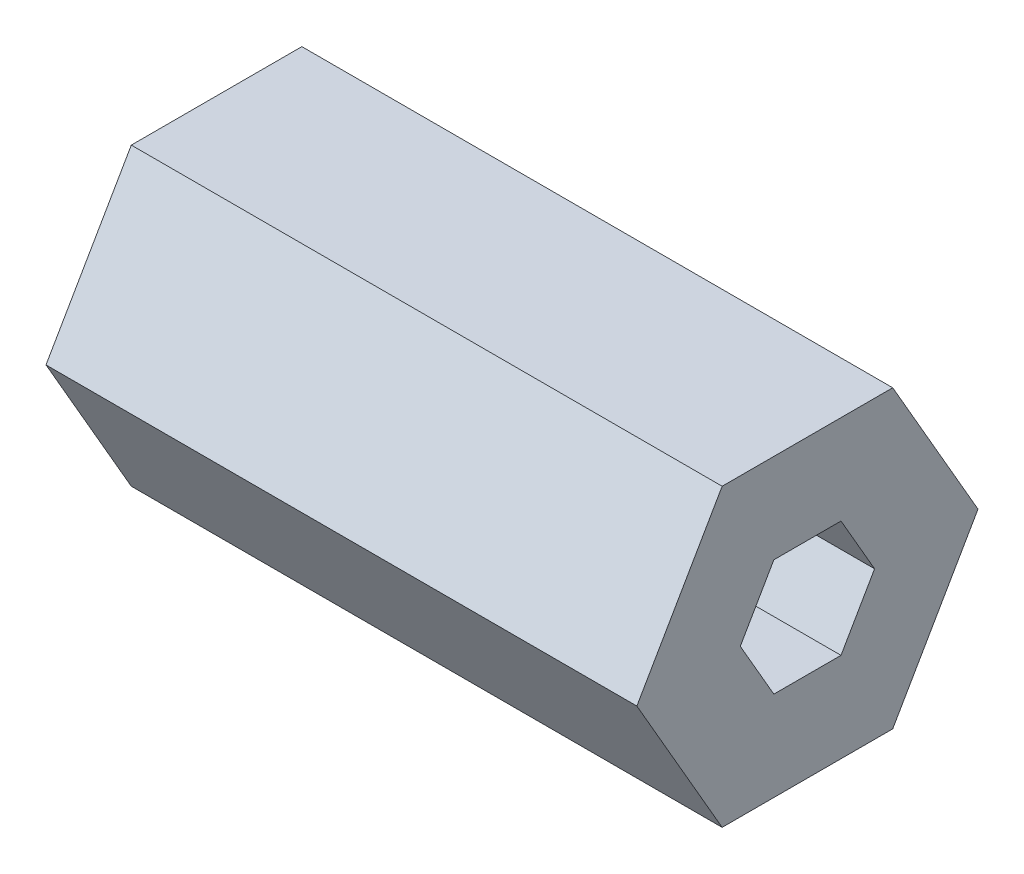
from build123d import *

# Parameters (mm, degrees)
BOSS_EXTRUDE1_DEPTH = 12.7


with BuildPart() as part:
    # Sketch1 → Boss-Extrude1 (new, symmetric)
    with BuildSketch(Plane(origin=(0, 0, 0), x_dir=(0, 0, -1), z_dir=(1, 0, 0))):
        Polygon((7.332348419, 0), (3.666174209, 6.35), (-3.666174209, 6.35), (-7.332348419, 0), (-3.666174209, -6.35), (3.666174209, -6.35), align=None)
        Polygon((2.886751346, 0), (1.443375673, 2.5), (-1.443375673, 2.5), (-2.886751346, 0), (-1.443375673, -2.5), (1.443375673, -2.5), align=None, mode=Mode.SUBTRACT)
    extrude(amount=BOSS_EXTRUDE1_DEPTH, both=True)


solid = part.part
